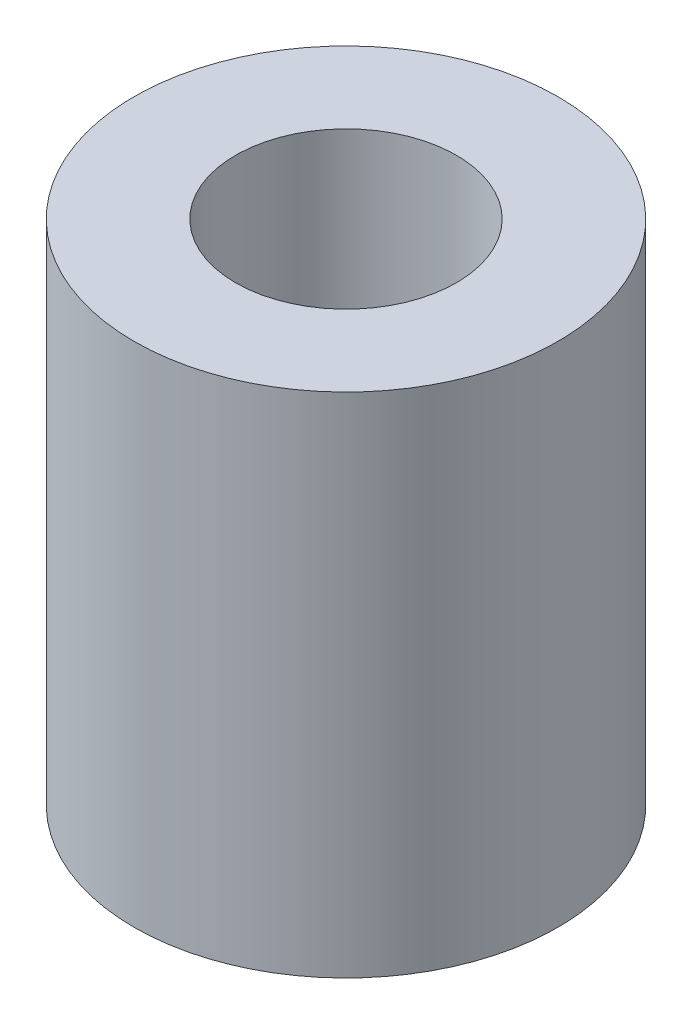
from build123d import *

# Parameters (mm, degrees)
SKETCH1_R           = 9.017
SKETCH1_R_2         = 4.699
BOSS_EXTRUDE1_DEPTH = 21.59


with BuildPart() as part:
    # Sketch1 → Boss-Extrude1 (new body)
    with BuildSketch(Plane(origin=(0, 0, 0), x_dir=(1, 0, 0), z_dir=(0, 1, 0))):
        with Locations(Location((-0.334442704, 0.106835864, 0), (0, 0, 270))):
            Circle(SKETCH1_R)
        with Locations(Location((-0.334442704, 0.106835864, 0), (0, 0, 270))):
            Circle(SKETCH1_R_2, mode=Mode.SUBTRACT)
    extrude(amount=BOSS_EXTRUDE1_DEPTH)


solid = part.part
